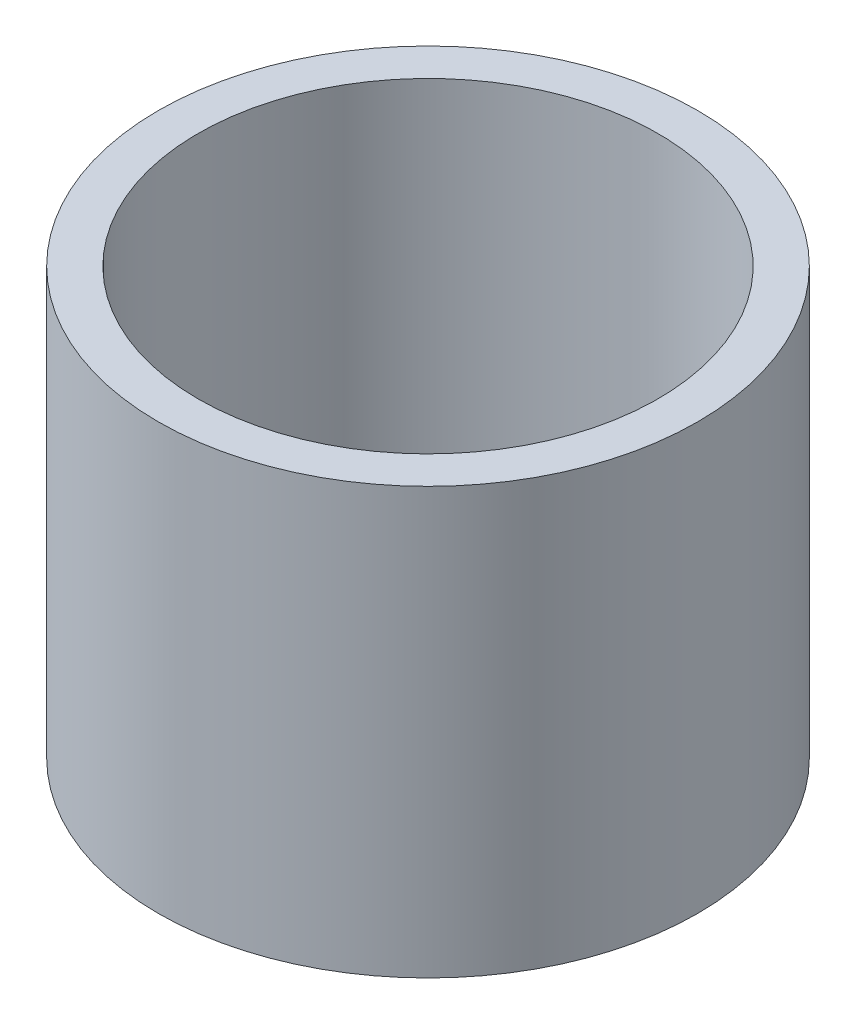
from build123d import *

# Parameters (mm, degrees)
SKETCH1_R      = 9.5
SKETCH1_R_2    = 8.1
EXTRUDE1_DEPTH = 15


with BuildPart() as part:
    # Sketch1 → Extrude1 (new body)
    with BuildSketch(Plane(origin=(0, 0, 0), x_dir=(1, 0, 0), z_dir=(0, 1, 0))):
        with Locations(Location((0, 0, 0), (0, 0, 270))):
            Circle(SKETCH1_R)
        with Locations(Location((0, 0, 0), (0, 0, 270))):
            Circle(SKETCH1_R_2, mode=Mode.SUBTRACT)
    extrude(amount=EXTRUDE1_DEPTH)


solid = part.part
